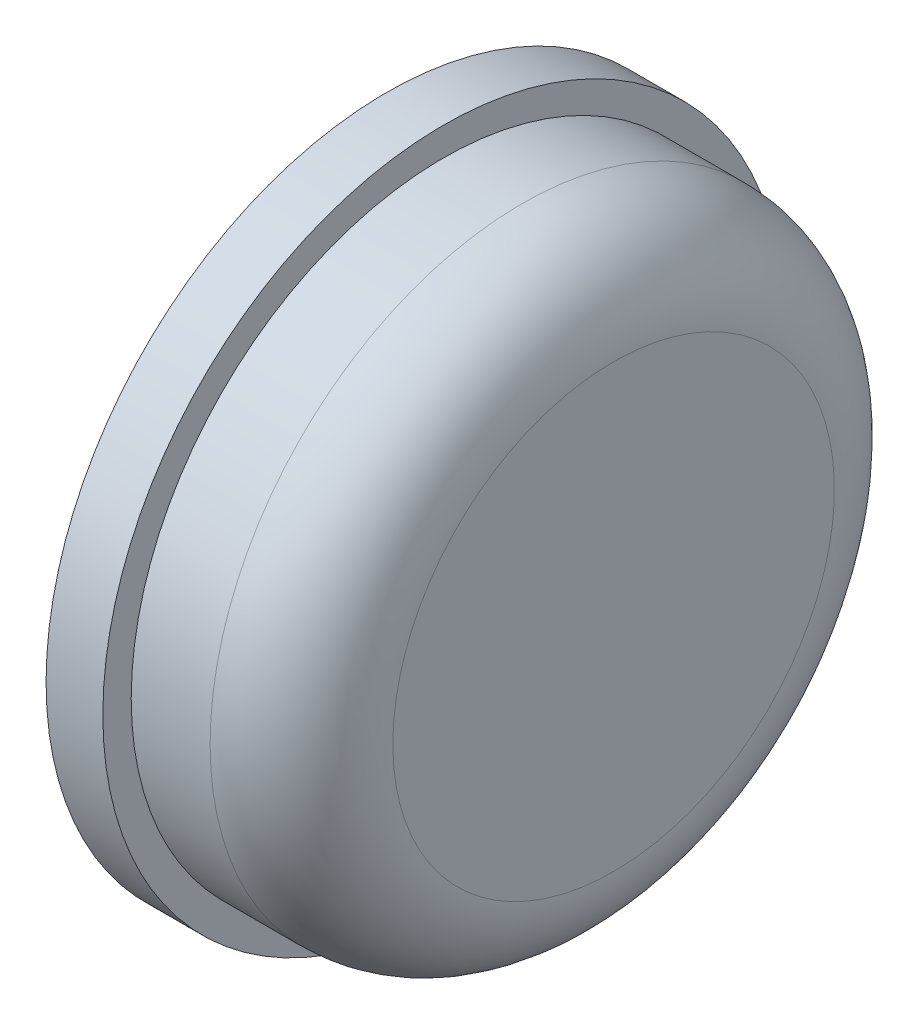
from build123d import *


with BuildPart() as part:
    # Sketch1 → Revolve1 (revolve)
    with BuildSketch(Plane(origin=(0, 0, 0), x_dir=(1, 0, 0), z_dir=(0, 1, 0)), mode=Mode.PRIVATE) as revolve1_sk:
        with BuildLine():
            Line((-10.83902439, 12), (-10.83902439, 9.979177887))
            Line((-10.83902439, 9.979177887), (-9.99958636, 9.979177887))
            ThreePointArc((-9.99958636, 9.979177887), (-10.508608574, 9.208564683), (-10.540029762, 8.285547331))
            Line((-10.540029762, 8.285547331), (-9.752554563, 6.222546257))
            ThreePointArc((-9.752554563, 6.222546257), (-8.141995388, 3.29472213), (-7.584446232, 0))
            Line((-7.584446232, 0), (-2.83902439, 0))
            Line((-2.83902439, 0), (-2.83902439, 7.780487805))
            ThreePointArc((-2.83902439, 7.780487805), (-3.78199768, 10.05702671), (-6.058536585, 11))
            Line((-6.058536585, 11), (-8.83902439, 11))
            Line((-8.83902439, 11), (-8.83902439, 12))
            Line((-8.83902439, 12), (-10.83902439, 12))
        make_face()
    revolve(revolve1_sk.sketch.rotate(Axis((0, 0, 0), (1, 0, 0)), 180), axis=Axis((0, 0, 0), (1, 0, 0)))


solid = part.part
